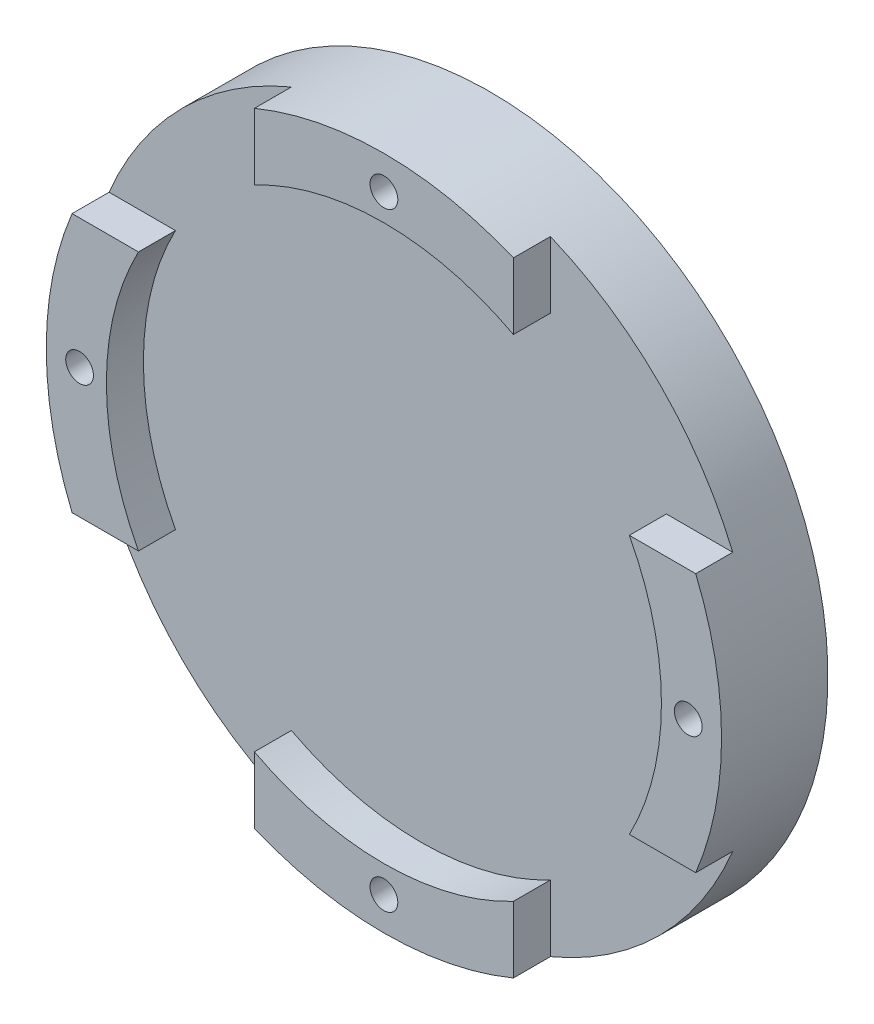
from build123d import *

# Parameters (mm, degrees)
SKETCH_1_R          = 36.5
EXTRUDE_1_DEPTH     = 6.5
CUT_EXTRUDE_START   = -4
CUT_EXTRUDE_2_DEPTH = 4
CUT_EXTRUDE_3_DEPTH = 4
SKETCH_6_R          = 1.5
CUT_EXTRUDE_5_DEPTH = 53.026435588
EXTRUDE_START       = 5
SKETCH_7_R          = 36.5
SKETCH_7_R_2        = 1.5
EXTRUDE_2_DEPTH     = 5
SKETCH_8_R          = 31.2
CUT_EXTRUDE_6_DEPTH = 5
SKETCH_9_R          = 3.5
EXTRUDE_3_DEPTH     = 8


with BuildPart() as part:
    # 草图1 → 凸台-拉伸1 (new body)
    with BuildSketch(Plane.XY):
        with Locations(Location((0, 0, 0), (0, 0, 180))):
            Circle(SKETCH_1_R)
    extrude(amount=EXTRUDE_1_DEPTH)

    # 草图3 → 切除-拉伸2 (cut)
    with BuildSketch(Plane.XY.offset(6.5).offset(CUT_EXTRUDE_START)):
        with BuildLine():
            Line((14, 33.708307581), (14, 26.532998323))
            ThreePointArc((14, 26.532998323), (21.213203436, 21.213203436), (26.532998323, 14))
            Line((26.532998323, 14), (33.708307581, 14))
            ThreePointArc((33.708307581, 14), (25.809397513, 25.809397513), (14, 33.708307581))
        make_face()
        with BuildLine():
            ThreePointArc((26.532998323, -14), (21.213203436, -21.213203436), (14, -26.532998323))
            Line((14, -26.532998323), (14, -33.708307581))
            ThreePointArc((14, -33.708307581), (25.809397513, -25.809397513), (33.708307581, -14))
            Line((33.708307581, -14), (26.532998323, -14))
        make_face()
        with BuildLine():
            Line((-14, -33.708307581), (-14, -26.532998323))
            ThreePointArc((-14, -26.532998323), (-21.213203436, -21.213203436), (-26.532998323, -14))
            Line((-26.532998323, -14), (-33.708307581, -14))
            ThreePointArc((-33.708307581, -14), (-25.809397513, -25.809397513), (-14, -33.708307581))
        make_face()
        with BuildLine():
            Line((-33.708307581, 14), (-26.532998323, 14))
            ThreePointArc((-26.532998323, 14), (-21.213203436, 21.213203436), (-14, 26.532998323))
            Line((-14, 26.532998323), (-14, 33.708307581))
            ThreePointArc((-14, 33.708307581), (-25.809397513, 25.809397513), (-33.708307581, 14))
        make_face()
    extrude(amount=CUT_EXTRUDE_2_DEPTH, mode=Mode.SUBTRACT)

    # 草图4 → 切除-拉伸3 (cut)
    with BuildSketch(Plane.XY.offset(6.5).offset(CUT_EXTRUDE_START)):
        with BuildLine():
            ThreePointArc((26.532998323, -14), (29.120353275, -7.211450974), (30, 0))
            ThreePointArc((30, 0), (29.120353275, 7.211450974), (26.532998323, 14))
            ThreePointArc((26.532998323, 14), (21.213203436, 21.213203436), (14, 26.532998323))
            ThreePointArc((14, 26.532998323), (0, 30), (-14, 26.532998323))
            ThreePointArc((-14, 26.532998323), (-21.213203436, 21.213203436), (-26.532998323, 14))
            ThreePointArc((-26.532998323, 14), (-30, 0), (-26.532998323, -14))
            ThreePointArc((-26.532998323, -14), (-21.213203436, -21.213203436), (-14, -26.532998323))
            ThreePointArc((-14, -26.532998323), (0, -30), (14, -26.532998323))
            ThreePointArc((14, -26.532998323), (21.213203436, -21.213203436), (26.532998323, -14))
        make_face()
    extrude(amount=CUT_EXTRUDE_3_DEPTH, mode=Mode.SUBTRACT)

    # 草图6 → 切除-拉伸5 (cut, through all)
    with BuildSketch(Plane(origin=(0, 0, 0), x_dir=(-1, 0, 0), z_dir=(0, 0, -1))):
        with Locations((32.9, 0)):
            Circle(SKETCH_6_R)
        with Locations((0, -32.9)):
            Circle(SKETCH_6_R)
        with Locations((0, 32.9)):
            Circle(SKETCH_6_R)
        with Locations((-32.9, 0)):
            Circle(SKETCH_6_R)
    extrude(amount=-CUT_EXTRUDE_5_DEPTH, mode=Mode.SUBTRACT)

    # 草图7 → 凸台-拉伸2 (add)
    with BuildSketch(Plane(origin=(0, 0, 0), x_dir=(-1, 0, 0), z_dir=(0, 0, -1)).offset(EXTRUDE_START)):
        Circle(SKETCH_7_R)
        with Locations((0, -32.9)):
            Circle(SKETCH_7_R_2, mode=Mode.SUBTRACT)
        with Locations((-32.9, 0)):
            Circle(SKETCH_7_R_2, mode=Mode.SUBTRACT)
        with Locations((0, 32.9)):
            Circle(SKETCH_7_R_2, mode=Mode.SUBTRACT)
        with Locations((32.9, 0)):
            Circle(SKETCH_7_R_2, mode=Mode.SUBTRACT)
    extrude(amount=-EXTRUDE_2_DEPTH)

    # 草图8 → 切除-拉伸6 (cut)
    with BuildSketch(Plane(origin=(0, 0, -5), x_dir=(-1, 0, 0), z_dir=(0, 0, -1))):
        Circle(SKETCH_8_R)
    extrude(amount=-CUT_EXTRUDE_6_DEPTH, mode=Mode.SUBTRACT)

    # 草图9 → 凸台-拉伸3 (add)
    with BuildSketch(Plane(origin=(0, 0, 0), x_dir=(-1, 0, 0), z_dir=(0, 0, -1))):
        Circle(SKETCH_9_R)
    extrude(amount=EXTRUDE_3_DEPTH)


solid = part.part
